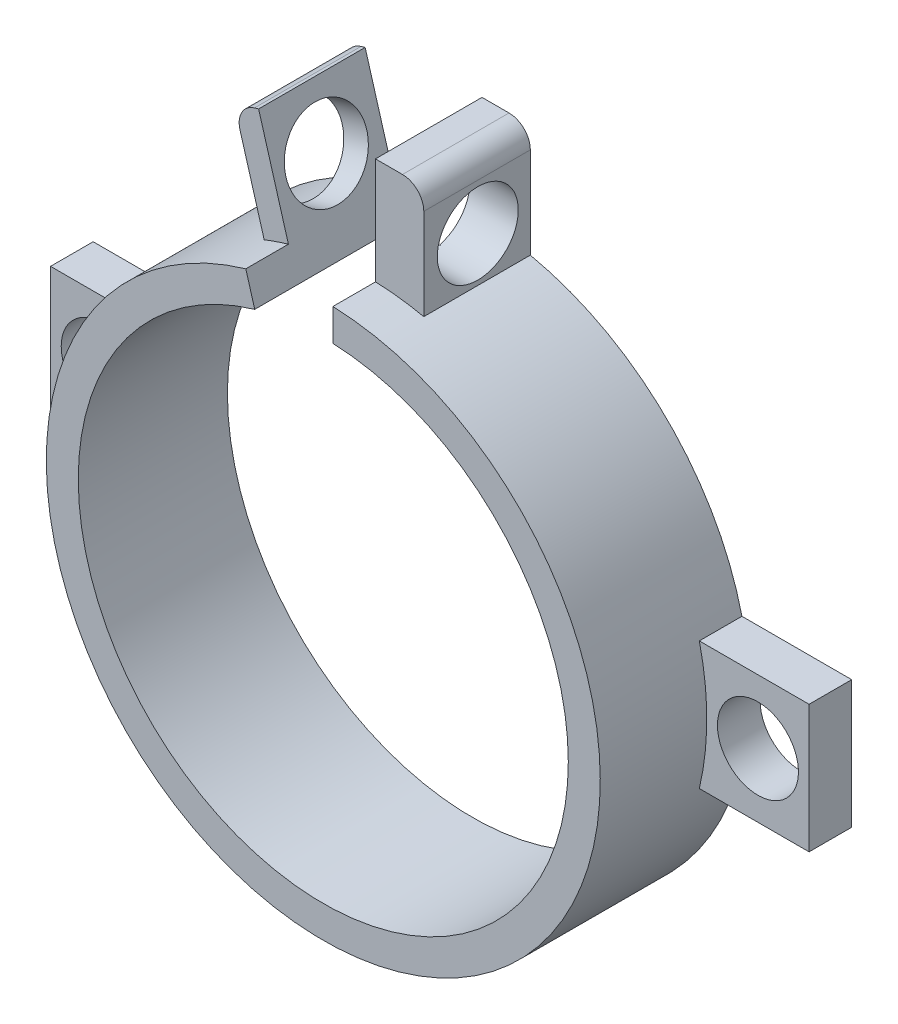
from build123d import *

# Parameters (mm, degrees)
BOSS_EXTRUDE1_DEPTH = 7
BOSS_EXTRUDE2_START = -2
SKETCH2_R           = 1.9
BOSS_EXTRUDE2_DEPTH = 2
BOSS_EXTRUDE3_START = -5
BOSS_EXTRUDE3_DEPTH = 5
SKETCH4_R           = 1.9
CUT_EXTRUDE1_DEPTH  = 5
BOSS_EXTRUDE4_START = -5
BOSS_EXTRUDE4_DEPTH = 5
SKETCH6_R           = 1.9
CUT_EXTRUDE2_DEPTH  = 4


with BuildPart() as part:
    # Sketch1 → Boss-Extrude1 (new body)
    with BuildSketch(Plane.XY):
        with BuildLine():
            Line((-3.636312194, 12.481075019), (-3.21673771, 11.040950978))
            ThreePointArc((-3.21673771, 11.040950978), (1.401778308, -11.414246255), (0.449573558, 11.491208971))
            Line((0.449573558, 11.491208971), (0.449573558, 12.992223967))
            ThreePointArc((0.449573558, 12.992223967), (1.613736067, -12.899451768), (-3.636312194, 12.481075019))
        make_face()
    extrude(amount=-BOSS_EXTRUDE1_DEPTH)

    # Sketch2 → Boss-Extrude2 (add)
    # profile 1 of 6: a face of its own
    with BuildSketch(Plane(origin=(0, 0, -7), x_dir=(-1, 0, 0), z_dir=(0, 0, -1)).offset(BOSS_EXTRUDE2_START)):
        Polygon((13, -1.4e-08), (13, -3), (17.8, -3), (17.8, 3), (13, 3), align=None)
        with Locations((15.4, 0)):
            Circle(SKETCH2_R, mode=Mode.SUBTRACT)
    # profile 2 of 6: a face of its own
    with BuildSketch(Plane(origin=(0, 0, -7), x_dir=(-1, 0, 0), z_dir=(0, 0, -1)).offset(BOSS_EXTRUDE2_START)):
        with BuildLine():
            ThreePointArc((13, -1.4e-08), (12.911979676, -1.510225432), (12.649110641, -3))
            Line((12.649110641, -3), (13, -3))
            Line((13, -3), (13, -1.4e-08))
        make_face()
    # profile 3 of 6: a face of its own
    with BuildSketch(Plane(origin=(0, 0, -7), x_dir=(-1, 0, 0), z_dir=(0, 0, -1)).offset(BOSS_EXTRUDE2_START)):
        with BuildLine():
            ThreePointArc((12.649110641, 3), (12.911979677, 1.510225419), (13, -1.4e-08))
            Line((13, -1.4e-08), (13, 3))
            Line((13, 3), (12.649110641, 3))
        make_face()
    # profile 4 of 6: a face of its own
    with BuildSketch(Plane(origin=(0, 0, -7), x_dir=(-1, 0, 0), z_dir=(0, 0, -1)).offset(BOSS_EXTRUDE2_START)):
        Polygon((-17.8, -3), (-13, -3), (-13, 2e-09), (-13, 3), (-17.8, 3), align=None)
        with Locations((-15.4, 0)):
            Circle(SKETCH2_R, mode=Mode.SUBTRACT)
    # profile 5 of 6: a face of its own
    with BuildSketch(Plane(origin=(0, 0, -7), x_dir=(-1, 0, 0), z_dir=(0, 0, -1)).offset(BOSS_EXTRUDE2_START)):
        with BuildLine():
            Line((-13, -3), (-12.649110641, -3))
            ThreePointArc((-12.649110641, -3), (-12.911979677, -1.510225425), (-13, 2e-09))
            Line((-13, 2e-09), (-13, -3))
        make_face()
    # profile 6 of 6: a face of its own
    with BuildSketch(Plane(origin=(0, 0, -7), x_dir=(-1, 0, 0), z_dir=(0, 0, -1)).offset(BOSS_EXTRUDE2_START)):
        with BuildLine():
            Line((-13, 3), (-13, 2e-09))
            ThreePointArc((-13, 2e-09), (-12.911979676, 1.510225426), (-12.649110641, 3))
            Line((-12.649110641, 3), (-13, 3))
        make_face()
    extrude(amount=BOSS_EXTRUDE2_DEPTH)

    # Sketch3 → Boss-Extrude3 (add)
    with BuildSketch(Plane(origin=(0, 0, -7), x_dir=(-1, 0, 0), z_dir=(0, 0, -1)).offset(BOSS_EXTRUDE3_START)):
        with BuildLine():
            Line((-1.717517475, 17.992223967), (-0.449573558, 17.992223967))
            Line((-0.449573558, 17.992223967), (-0.449573558, 13))
            Line((-0.449573558, 13), (-2.717517475, 13))
            Line((-2.717517475, 13), (-2.717517475, 16.992223967))
            ThreePointArc((-2.717517475, 16.992223967), (-2.424624256, 17.699330748), (-1.717517475, 17.992223967))
        make_face()
        with BuildLine():
            Line((-0.595067825, 12.986373408), (-2.717517475, 12.889117574))
            Line((-2.717517475, 12.889117574), (-2.717517475, 12.712792721))
            ThreePointArc((-2.717517475, 12.712792721), (-1.661931689, 12.893330953), (-0.595067825, 12.986373408))
        make_face()
        Polygon((-2.717517475, 13), (-2.717517475, 12.889117574), (-0.595067825, 12.986373408), (-0.449573558, 12.993040311), (-0.449573558, 13), align=None)
    extrude(amount=BOSS_EXTRUDE3_DEPTH)

    # Sketch4 → Cut-Extrude1 (cut)
    with BuildSketch(Plane(origin=(2.717517475, 0, 0), x_dir=(0, 0, -1), z_dir=(1, 0, 0))):
        with Locations(Location((4.533929619, 14.83079483, 0), (0, 0, 90))):
            Circle(SKETCH4_R)
    extrude(amount=-CUT_EXTRUDE1_DEPTH, mode=Mode.SUBTRACT)

    # Sketch5 → Boss-Extrude4 (add)
    with BuildSketch(Plane(origin=(0, 0, -7), x_dir=(-1, 0, 0), z_dir=(0, 0, -1)).offset(BOSS_EXTRUDE4_START)):
        with BuildLine():
            Line((5.034893807, 17.281488488), (3.691292994, 12.669788048))
            Line((3.691292994, 12.669788048), (4.784802098, 12.133026974))
            Line((4.784802098, 12.133026974), (5.907276717, 15.985746207))
            ThreePointArc((5.907276717, 15.985746207), (5.823864315, 16.746554204), (5.226910346, 17.225545223))
            Line((5.226910346, 17.225545223), (5.034893807, 17.281488488))
        make_face()
        with BuildLine():
            Line((4.784802098, 12.133026974), (3.691292994, 12.669788048))
            Line((3.691292994, 12.669788048), (3.636312194, 12.481075019))
            ThreePointArc((3.636312194, 12.481075019), (4.209094298, 12.299736793), (4.772886303, 12.092127866))
            Line((4.772886303, 12.092127866), (4.784802098, 12.133026974))
        make_face()
    extrude(amount=BOSS_EXTRUDE4_DEPTH)

    # Sketch6 → Cut-Extrude2 (cut)
    with BuildSketch(Plane(origin=(-1.152099233, -0.335659587, 0), x_dir=(0, 0, 1), z_dir=(-0.9600826937679848, -0.2797163225970375, 0))):
        with Locations(Location((-4.412219036, 15.262129774, 0), (0, 0, 66.15869914))):
            Circle(SKETCH6_R)
    extrude(amount=-CUT_EXTRUDE2_DEPTH, mode=Mode.SUBTRACT)


solid = part.part
